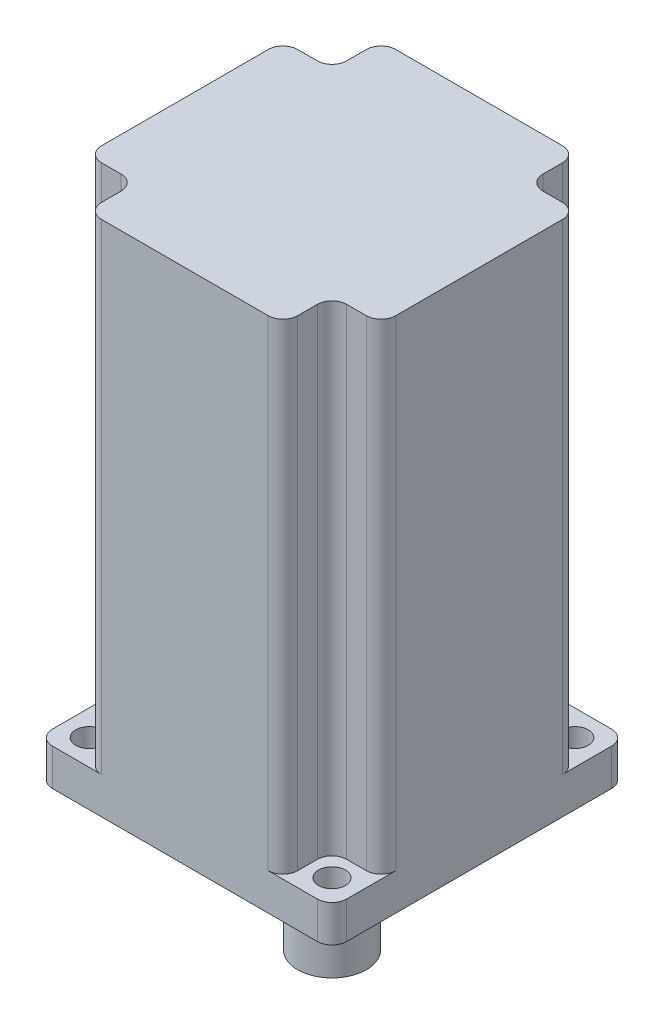
from build123d import *

# Parameters (mm, degrees)
SKETCH1_R           = 2.75
BOSS_EXTRUDE1_DEPTH = 7.5
BOSS_EXTRUDE2_DEPTH = 98
FILLET1_R           = 3
SKETCH4_R           = 25
BOSS_EXTRUDE4_DEPTH = 3
SKETCH5_R           = 7
BOSS_EXTRUDE5_DEPTH = 27


with BuildPart() as part:
    # Sketch1 → Boss-Extrude1 (new body)
    with BuildSketch(Plane(origin=(0, 0, 0), x_dir=(1, 0, 0), z_dir=(0, 1, 0))):
        with BuildLine():
            Line((-27, -30), (27, -30))
            ThreePointArc((27, -30), (29.121320344, -29.121320344), (30, -27))
            Line((30, -27), (30, 27))
            ThreePointArc((30, 27), (29.121320344, 29.121320344), (27, 30))
            Line((27, 30), (-27, 30))
            ThreePointArc((-27, 30), (-29.121320344, 29.121320344), (-30, 27))
            Line((-30, 27), (-30, -27))
            ThreePointArc((-30, -27), (-29.121320344, -29.121320344), (-27, -30))
        make_face()
        with Locations(Location((-24.748737342, 24.748737342, 0), (0, 0, 270))):
            Circle(SKETCH1_R, mode=Mode.SUBTRACT)
        with Locations(Location((24.748737342, 24.748737342, 0), (0, 0, 270))):
            Circle(SKETCH1_R, mode=Mode.SUBTRACT)
        with Locations(Location((-24.748737342, -24.748737342, 0), (0, 0, 90))):
            Circle(SKETCH1_R, mode=Mode.SUBTRACT)
        with Locations(Location((24.748737342, -24.748737342, 0), (0, 0, 90))):
            Circle(SKETCH1_R, mode=Mode.SUBTRACT)
    extrude(amount=BOSS_EXTRUDE1_DEPTH)

    # Sketch2 → Boss-Extrude2 (add)
    with BuildSketch(Plane(origin=(0, 7.5, 0), x_dir=(1, 0, 0), z_dir=(0, 1, 0))):
        Polygon((-20, 30), (20, 30), (20, 20), (30, 20), (30, -20), (20, -20), (20, -30), (-20, -30), (-20, -20), (-30, -20), (-30, 20), (-20, 20), align=None)
    extrude(amount=BOSS_EXTRUDE2_DEPTH)

    # Fillet1
    fillet1_edges = [part.edges().sort_by_distance(p)[0] for p in [
        (-20, 56.5, -30),
        (-20, 56.5, -20),
        (-30, 56.5, -20),
        (-30, 56.5, 20),
        (-20, 56.5, 20),
        (-20, 56.5, 30),
        (20, 56.5, 30),
        (20, 56.5, 20),
        (30, 56.5, 20),
        (30, 56.5, -20),
        (20, 56.5, -20),
        (20, 56.5, -30),
    ]]
    fillet(fillet1_edges, radius=FILLET1_R)

    # Sketch4 → Boss-Extrude4 (add)
    with BuildSketch(Plane.XZ):
        with Locations(Location((0, 0, 0), (0, 0, 270))):
            Circle(SKETCH4_R)
    extrude(amount=BOSS_EXTRUDE4_DEPTH)

    # Sketch5 → Boss-Extrude5 (add)
    with BuildSketch(Plane.XZ.offset(3)):
        with Locations(Location((0, 0, 0), (0, 0, 270))):
            Circle(SKETCH5_R)
    extrude(amount=BOSS_EXTRUDE5_DEPTH)


solid = part.part
